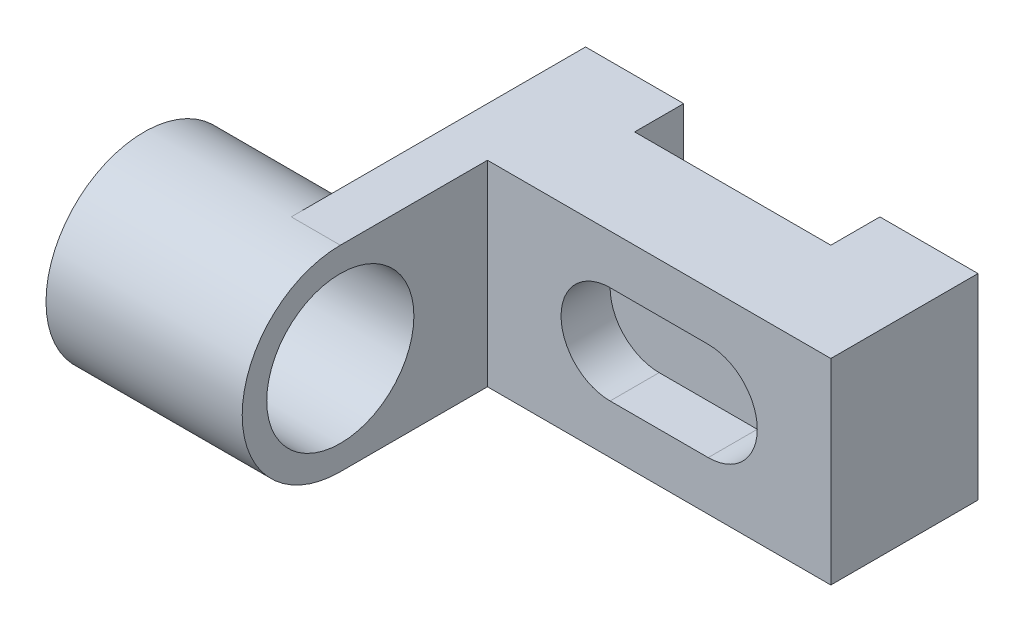
from build123d import *

# Parameters (mm, degrees)
SKETCH_1_W          = 80
SKETCH_1_H          = 40
EXTRUDE_1_DEPTH     = 30
SKETCH_2_W          = 40
SKETCH_2_H          = 13.147576883
CUT_EXTRUDE_1_DEPTH = 65.031242374
CUT_EXTRUDE_2_DEPTH = 10
SKETCH_5_R          = 15
EXTRUDE_2_DEPTH     = 10
EXTRUDE_START       = 30
SKETCH_6_R          = 20
SKETCH_6_R_2        = 15
EXTRUDE_3_DEPTH     = 30


with BuildPart() as part:
    # 草圖1 → 填料-伸長1 (new body)
    with BuildSketch(Plane.XY):
        Rectangle(SKETCH_1_W, SKETCH_1_H)
    extrude(amount=EXTRUDE_1_DEPTH)

    # 草圖2 → 除料-伸長1 (cut, through all)
    with BuildSketch(Plane.XZ.offset(20)):
        with Locations((0, 3.426211558)):
            Rectangle(SKETCH_2_W, SKETCH_2_H)
    extrude(amount=-CUT_EXTRUDE_1_DEPTH, mode=Mode.SUBTRACT)

    # 草圖3 → 除料-伸長2 (cut)
    with BuildSketch(Plane.XY.offset(30)):
        with BuildLine():
            Line((15, -10), (-5, -10))
            ThreePointArc((-5, -10), (-15, 0), (-5, 10))
            Line((-5, 10), (15, 10))
            ThreePointArc((15, 10), (25, 0), (15, -10))
        make_face()
    extrude(amount=-CUT_EXTRUDE_2_DEPTH, mode=Mode.SUBTRACT)

    # 草圖5 → 填料-伸長2 (add)
    with BuildSketch(Plane.ZY.offset(40)):
        with BuildLine():
            Line((30, -20), (60, -20))
            ThreePointArc((60, -20), (80, 0), (60, 20))
            Line((60, 20), (30, 20))
            Line((30, 20), (30, -20))
        make_face()
        with Locations((60, 0)):
            Circle(SKETCH_5_R, mode=Mode.SUBTRACT)
    extrude(amount=-EXTRUDE_2_DEPTH)

    # 草圖6 → 填料-伸長3 (add)
    with BuildSketch(Plane.ZY.offset(40).offset(EXTRUDE_START)):
        with Locations((60, 0)):
            Circle(SKETCH_6_R)
        with Locations((60, 0)):
            Circle(SKETCH_6_R_2, mode=Mode.SUBTRACT)
    extrude(amount=-EXTRUDE_3_DEPTH)


solid = part.part
